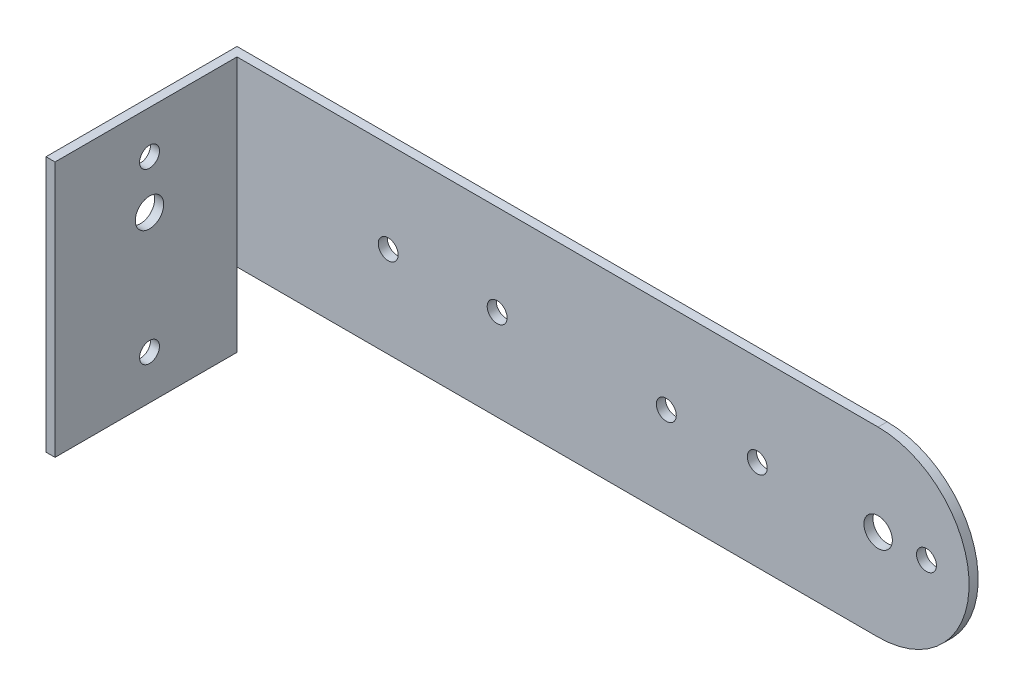
from build123d import *

# Parameters (mm, degrees)
BOSS_EXTRUDE1_DEPTH = 1.59
SKETCH2_W           = 1.59
SKETCH2_H           = 45
BOSS_EXTRUDE2_DEPTH = 32
SKETCH3_R           = 2.5
SKETCH3_R_2         = 1.75
CUT_EXTRUDE1_DEPTH  = 123.223711284
SKETCH4_R           = 2.5
SKETCH4_R_2         = 1.75
CUT_EXTRUDE2_DEPTH  = 138.687340377


with BuildPart() as part:
    # Sketch1 → Boss-Extrude1 (new body)
    with BuildSketch(Plane.XY):
        with BuildLine():
            Line((0, 16), (-114.34, 16))
            Line((-114.34, 16), (-114.34, -16))
            Line((-114.34, -16), (0, -16))
            ThreePointArc((0, -16), (16, 0), (0, 16))
        make_face()
    extrude(amount=BOSS_EXTRUDE1_DEPTH)

    # Sketch2 → Boss-Extrude2 (add)
    with BuildSketch(Plane.XY.offset(1.59)):
        with Locations((-113.545, -6.5)):
            Rectangle(SKETCH2_W, SKETCH2_H)
    extrude(amount=BOSS_EXTRUDE2_DEPTH)

    # Sketch3 → Cut-Extrude1 (cut, through all)
    with BuildSketch(Plane.XY.offset(1.59)):
        Circle(SKETCH3_R)
        with Locations((8.5, 0)):
            Circle(SKETCH3_R_2)
        with Locations((-21.25, 0)):
            Circle(SKETCH3_R_2)
        with Locations((-37.25, 0)):
            Circle(SKETCH3_R_2)
        with Locations((-67, 0)):
            Circle(SKETCH3_R_2)
        with Locations((-86.16, 0)):
            Circle(SKETCH3_R_2)
    extrude(amount=-CUT_EXTRUDE1_DEPTH, mode=Mode.SUBTRACT)

    # Sketch4 → Cut-Extrude2 (cut, through all)
    with BuildSketch(Plane.ZY.offset(114.34)):
        with Locations((16.975, 0)):
            Circle(SKETCH4_R)
        with Locations((16.975, 8.5)):
            Circle(SKETCH4_R_2)
        with Locations((16.975, -21.25)):
            Circle(SKETCH4_R_2)
    extrude(amount=-CUT_EXTRUDE2_DEPTH, mode=Mode.SUBTRACT)


solid = part.part
